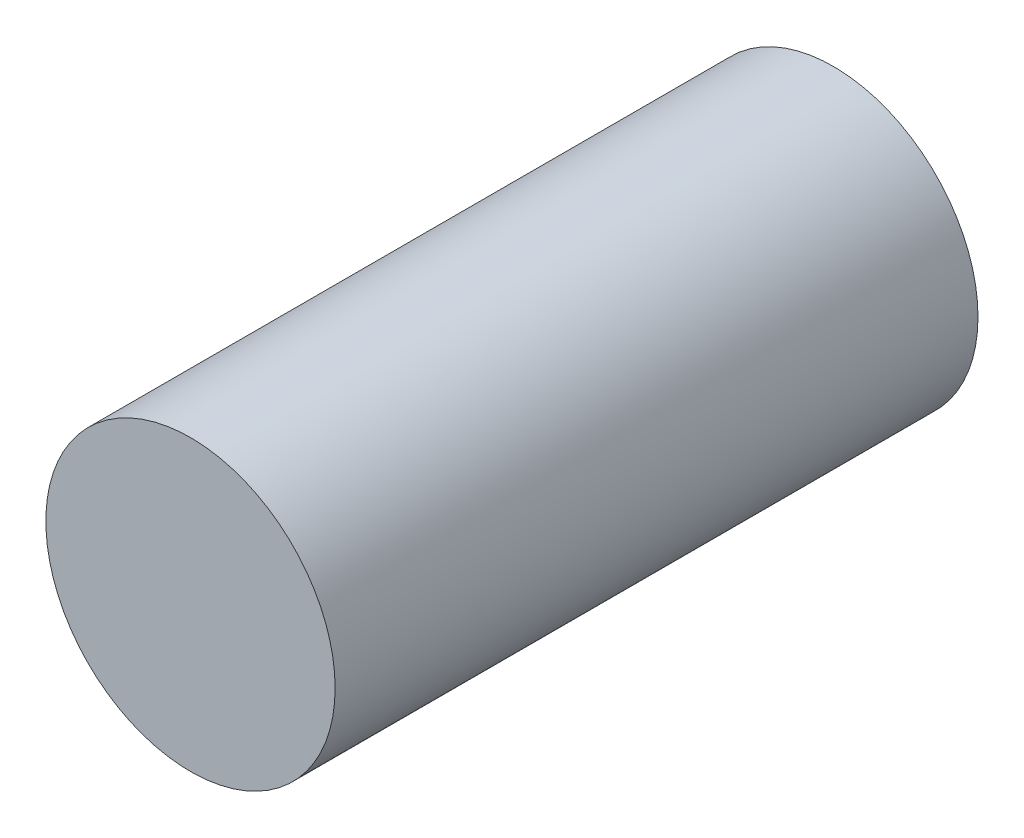
from build123d import *

# Parameters (mm, degrees)
SKETCH_1_R      = 2.25
EXTRUDE_1_DEPTH = 10


with BuildPart() as part:
    # 스케치1 → 보스-돌출1 (new body)
    with BuildSketch(Plane.XY):
        Circle(SKETCH_1_R)
    extrude(amount=EXTRUDE_1_DEPTH)


solid = part.part
